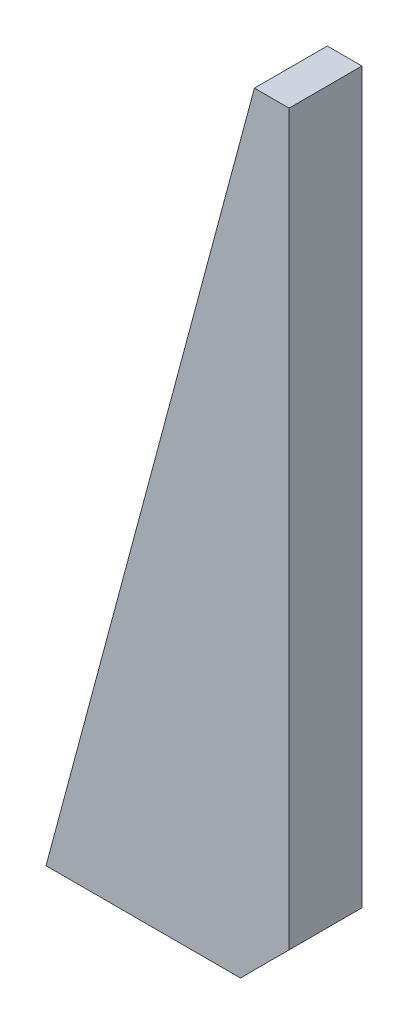
from build123d import *

# Parameters (mm, degrees)
EXTRUDE_1_DEPTH = 15
CHAMFER_1_SIZE  = 10


with BuildPart() as part:
    # 草圖1 → 擠出1 (new body)
    with BuildSketch(Plane.XY):
        Polygon((0, 0), (-50, 0), (-7.128129211, 160), (0, 160), align=None)
    extrude(amount=-EXTRUDE_1_DEPTH)

    # 倒角1
    chamfer_1_edges = [part.edges().sort_by_distance(p)[0] for p in [
        (0, 0, -7.5),
    ]]
    chamfer(chamfer_1_edges, length=CHAMFER_1_SIZE)


solid = part.part
